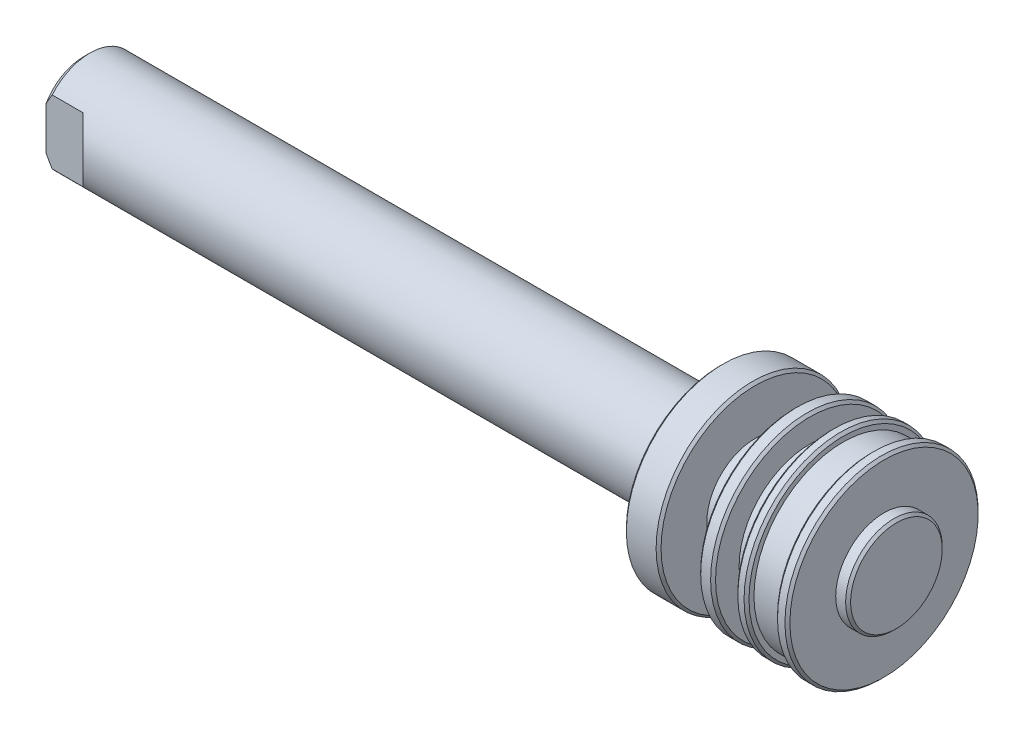
from build123d import *

# Parameters (mm, degrees)
CUT_EXTRUDE_1_DEPTH      = 8
CUT_EXTRUDE_1_DEPTH_BACK = 8


with BuildPart() as part:
    # 草图1 → 旋转1 (revolve)
    with BuildSketch(Plane.XY):
        Polygon((0, 0), (0, 3.5), (0.5, 4), (51.4, 4), (51.4, 7.6), (51.6, 7.8), (54, 7.8), (54.2, 7.6), (54.2, 3.9), (57.4, 3.9), (57.4, 7.6), (57.6, 7.8), (58.4, 7.8), (58.6, 7.6), (58.6, 5.7), (60.4, 5.7), (60.4, 7.6), (60.6, 7.8), (61.1, 7.8), (61.3, 7.6), (61.3, 7.2), (63.6, 7.2), (63.6, 7.6), (63.8, 7.8), (64.4, 7.8), (64.6, 7.6), (64.6, 3.9), (65.4, 3.9), (65.6, 3.7), (65.6, 0), align=None)
    revolve(axis=Axis((65.6, 0, 0), (-1, 0, 0)))

    # 草图2 → 切除-旋转1 (revolve, cut)
    with BuildSketch(Plane.XY):
        Polygon((0, 0), (0, 2), (0.379, 1.621), (10.8, 1.621), (11.735884786, 0), align=None)
    revolve(axis=Axis((11.735884786, 0, 0), (-1, 0, 0)), mode=Mode.SUBTRACT)

    # 草图3 → 切除-拉伸1 (cut, two sides: drawn at the far end of the back side and taken through both)
    with BuildSketch(Plane(origin=(0, 0, 0), x_dir=(1, 0, 0), z_dir=(0, 1, 0)).offset(-CUT_EXTRUDE_1_DEPTH_BACK)):
        Polygon((-9.2, -10.121067812), (10.071067812, -10.121067812), (3, -3.05), (0, -3.05), (0, 3.05), (3, 3.05), (10.071067812, 10.121067812), (-9.2, 10.121067812), align=None)
    extrude(amount=CUT_EXTRUDE_1_DEPTH + CUT_EXTRUDE_1_DEPTH_BACK, mode=Mode.SUBTRACT)


solid = part.part
